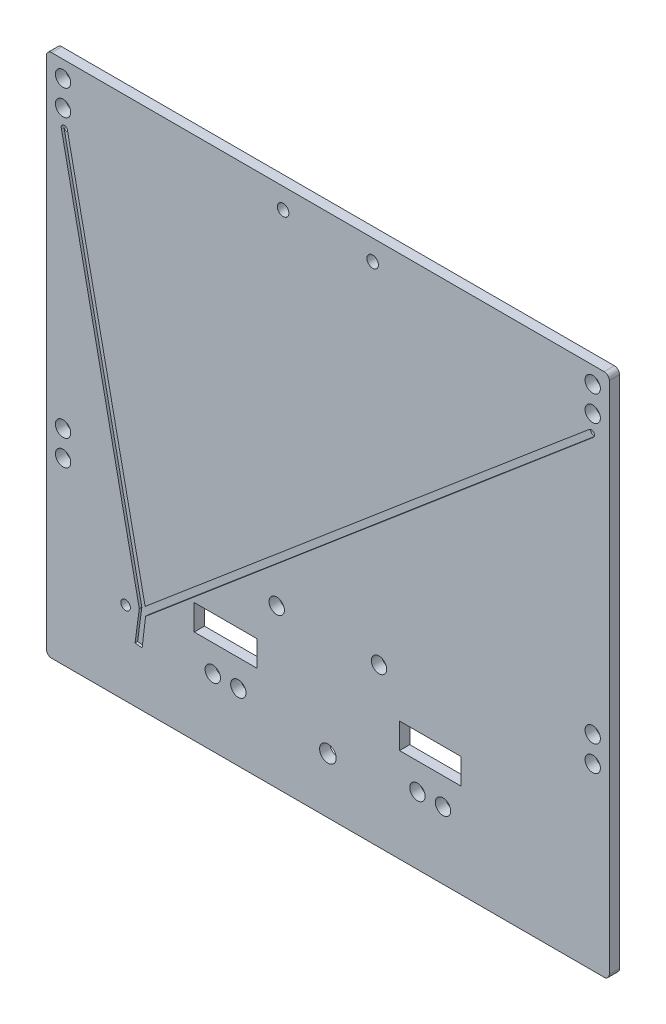
from build123d import *

# Parameters (mm, degrees)
SKETCH1_R           = 6
SKETCH1_R_2         = 4.5
SKETCH1_R_3         = 6.5
SKETCH1_R_4         = 3.735
SKETCH1_W           = 48
SKETCH1_H           = 20
SKETCH1_W_2         = 49
BOSS_EXTRUDE1_DEPTH = 8
SKETCH2_R           = 2.5
CUT_EXTRUDE1_DEPTH  = 10
CUT_EXTRUDE2_DEPTH  = 2


with BuildPart() as part:
    # Sketch1 → Boss-Extrude1 (new body)
    with BuildSketch(Plane(origin=(0, 0, 384.620141885), x_dir=(-1, 0, 0), z_dir=(0, 0, -1))):
        with BuildLine():
            Line((-108.789156386, -197.798939869), (-108.789156386, -599.798939869))
            ThreePointArc((-108.789156386, -599.798939869), (-107.617583511, -602.627366994), (-104.789156386, -603.798939869))
            Line((-104.789156386, -603.798939869), (327.210843614, -603.798939869))
            ThreePointArc((327.210843614, -603.798939869), (330.039270738, -602.627366994), (331.210843614, -599.798939869))
            Line((331.210843614, -599.798939869), (331.210843614, -197.798939869))
            ThreePointArc((331.210843614, -197.798939869), (330.039270738, -194.970512745), (327.210843614, -193.798939869))
            Line((327.210843614, -193.798939869), (-104.789156386, -193.798939869))
            ThreePointArc((-104.789156386, -193.798939869), (-107.617583511, -194.970512745), (-108.789156386, -197.798939869))
        make_face()
        with Locations((-95.789156386, -206.798939869)):
            Circle(SKETCH1_R, mode=Mode.SUBTRACT)
        with Locations((-95.789156386, -226.798939869)):
            Circle(SKETCH1_R, mode=Mode.SUBTRACT)
        with Locations((146.210843614, -209.798939869)):
            Circle(SKETCH1_R_2, mode=Mode.SUBTRACT)
        with Locations((76.210843614, -209.798939869)):
            Circle(SKETCH1_R_2, mode=Mode.SUBTRACT)
        with Locations((318.210843614, -206.798939869)):
            Circle(SKETCH1_R, mode=Mode.SUBTRACT)
        with Locations((318.210843614, -226.798939869)):
            Circle(SKETCH1_R, mode=Mode.SUBTRACT)
        with Locations((-95.789156386, -443.798939869)):
            Circle(SKETCH1_R, mode=Mode.SUBTRACT)
        with Locations((-95.789156386, -463.798939869)):
            Circle(SKETCH1_R, mode=Mode.SUBTRACT)
        with Locations((318.210843614, -443.798939869)):
            Circle(SKETCH1_R, mode=Mode.SUBTRACT)
        with Locations((318.210843614, -463.798939869)):
            Circle(SKETCH1_R, mode=Mode.SUBTRACT)
        with Locations((71.210843614, -480.298939869)):
            Circle(SKETCH1_R, mode=Mode.SUBTRACT)
        with Locations((151.210843614, -480.298939869)):
            Circle(SKETCH1_R, mode=Mode.SUBTRACT)
        with Locations((21.210843614, -551.298939869)):
            Circle(SKETCH1_R, mode=Mode.SUBTRACT)
        with Locations((41.210843614, -551.298939869)):
            Circle(SKETCH1_R, mode=Mode.SUBTRACT)
        with Locations((111.210843614, -560.298939869)):
            Circle(SKETCH1_R_3, mode=Mode.SUBTRACT)
        with Locations((181.210843614, -551.298939869)):
            Circle(SKETCH1_R, mode=Mode.SUBTRACT)
        with Locations((269.360529317, -538.868166644)):
            Circle(SKETCH1_R_4, mode=Mode.SUBTRACT)
        with Locations((201.210843614, -551.298939869)):
            Circle(SKETCH1_R, mode=Mode.SUBTRACT)
        with Locations((31.210843614, -520.298939869)):
            Rectangle(SKETCH1_W, SKETCH1_H, mode=Mode.SUBTRACT)
        with Locations((191.210843614, -520.298939869)):
            Rectangle(SKETCH1_W_2, SKETCH1_H, mode=Mode.SUBTRACT)
    extrude(amount=BOSS_EXTRUDE1_DEPTH)

    # Sketch2 → Cut-Extrude1 (cut)
    with BuildSketch(Plane(origin=(0, 0, 384.620141885), x_dir=(-1, 0, 0), z_dir=(0, 0, -1))):
        with Locations((-94.688937296, -240.632664804)):
            Circle(SKETCH2_R)
        with Locations((317.195009352, -240.632664804)):
            Circle(SKETCH2_R)
    extrude(amount=CUT_EXTRUDE1_DEPTH, mode=Mode.SUBTRACT)

    # Sketch3 → Cut-Extrude2 (cut)
    with BuildSketch(Plane.XY.offset(384.620141885)):
        Polygon((92.937374464, -238.848840921), (96.278253898, -242.562450475), (-253.706289527, -538.668659239), (-256.416648587, -561.465752351), (-261.936974764, -560.809437707), (-258.651893581, -536.026212702), (-319.695009352, -240.632664804), (-314.695009352, -240.632664804), (-254.069511981, -532.152999711), align=None)
    extrude(amount=-CUT_EXTRUDE2_DEPTH, mode=Mode.SUBTRACT)


solid = part.part
